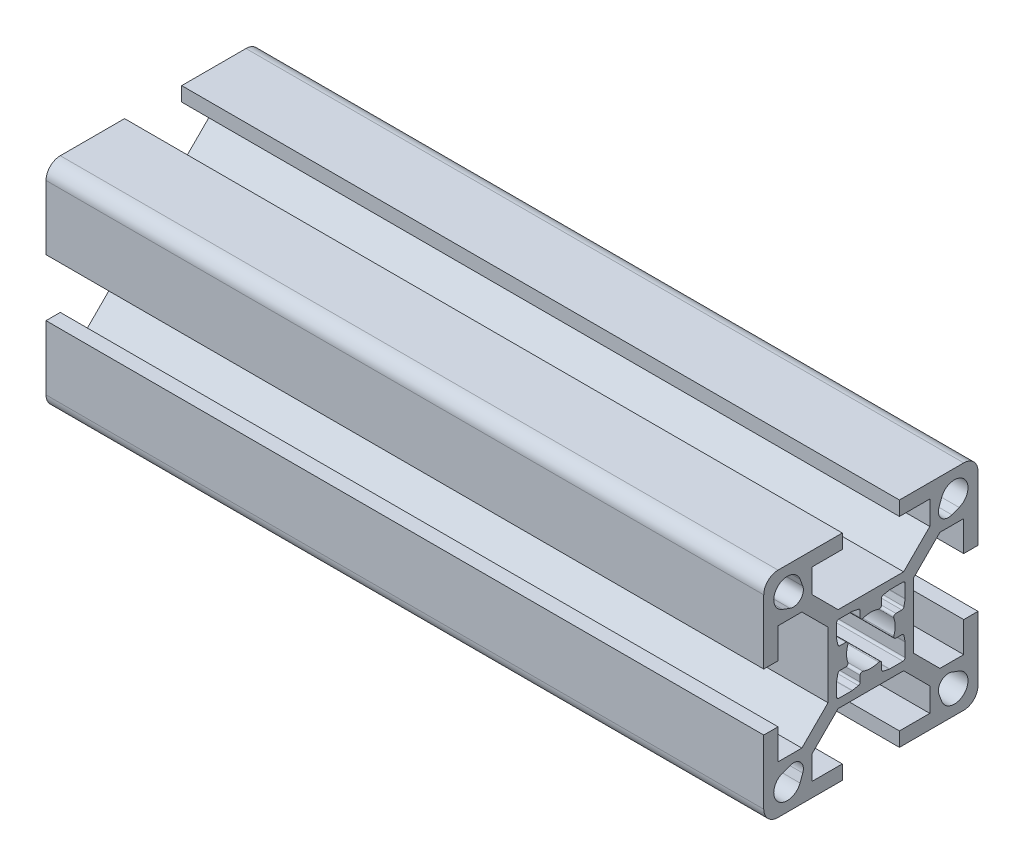
from build123d import *

# Parameters (mm, degrees)
BOSS_EXTRUDE1_DEPTH = 100.5


with BuildPart() as part:
    # Sketch1 → Boss-Extrude1 (new body)
    with BuildSketch(Plane(origin=(0, 0, 0), x_dir=(0, 0, -1), z_dir=(1, 0, 0))):
        with BuildLine():
            Line((-15, 13), (-15, 4))
            Line((-15, 4), (-13, 4))
            Line((-13, 4), (-13, 8.25))
            Line((-13, 8.25), (-9.664213562, 8.25))
            Line((-9.664213562, 8.25), (-6, 4.585786438))
            Line((-6, 4.585786438), (-6, -4.585786438))
            Line((-6, -4.585786438), (-9.664213562, -8.25))
            Line((-9.664213562, -8.25), (-13, -8.25))
            Line((-13, -8.25), (-13, -4))
            Line((-13, -4), (-15, -4))
            Line((-15, -4), (-15, -13))
            ThreePointArc((-15, -13), (-14.414213562, -14.414213562), (-13, -15))
            Line((-13, -15), (-4, -15))
            Line((-4, -15), (-4, -13))
            Line((-4, -13), (-8.25, -13))
            Line((-8.25, -13), (-8.25, -9.664213562))
            Line((-8.25, -9.664213562), (-4.585786438, -6))
            Line((-4.585786438, -6), (4.585786438, -6))
            Line((4.585786438, -6), (8.25, -9.664213562))
            Line((8.25, -9.664213562), (8.25, -13))
            Line((8.25, -13), (4, -13))
            Line((4, -13), (4, -15))
            Line((4, -15), (13, -15))
            ThreePointArc((13, -15), (14.414213562, -14.414213562), (15, -13))
            Line((15, -13), (15, -4))
            Line((15, -4), (13, -4))
            Line((13, -4), (13, -8.25))
            Line((13, -8.25), (9.664213562, -8.25))
            Line((9.664213562, -8.25), (6, -4.585786438))
            Line((6, -4.585786438), (6, 4.585786438))
            Line((6, 4.585786438), (9.664213562, 8.25))
            Line((9.664213562, 8.25), (13, 8.25))
            Line((13, 8.25), (13, 4))
            Line((13, 4), (15, 4))
            Line((15, 4), (15, 13))
            ThreePointArc((15, 13), (14.414213562, 14.414213562), (13, 15))
            Line((13, 15), (4, 15))
            Line((4, 15), (4, 13))
            Line((4, 13), (8.25, 13))
            Line((8.25, 13), (8.25, 9.664213562))
            Line((8.25, 9.664213562), (4.585786438, 6))
            Line((4.585786438, 6), (-4.585786438, 6))
            Line((-4.585786438, 6), (-8.25, 9.664213562))
            Line((-8.25, 9.664213562), (-8.25, 13))
            Line((-8.25, 13), (-4, 13))
            Line((-4, 13), (-4, 15))
            Line((-4, 15), (-13, 15))
            ThreePointArc((-13, 15), (-14.414213562, 14.414213562), (-15, 13))
        make_face()
        with BuildLine():
            Line((-9.539070071, 11.338915743), (-9.918883282, 12.361530981))
            ThreePointArc((-9.918883282, 12.361530981), (-13.043502884, 13.043502884), (-12.361530981, 9.918883282))
            Line((-12.361530981, 9.918883282), (-11.338915743, 9.539070071))
            ThreePointArc((-11.338915743, 9.539070071), (-9.861522369, 9.861522369), (-9.539070071, 11.338915743))
        make_face(mode=Mode.SUBTRACT)
        with BuildLine():
            Line((9.918883282, 12.361530981), (9.539070071, 11.338915743))
            ThreePointArc((9.539070071, 11.338915743), (9.861522369, 9.861522369), (11.338915743, 9.539070071))
            Line((11.338915743, 9.539070071), (12.361530981, 9.918883282))
            ThreePointArc((12.361530981, 9.918883282), (13.043502884, 13.043502884), (9.918883282, 12.361530981))
        make_face(mode=Mode.SUBTRACT)
        with BuildLine():
            Line((12.361530981, -9.918883282), (11.338915743, -9.539070071))
            ThreePointArc((11.338915743, -9.539070071), (9.861522369, -9.861522369), (9.539070071, -11.338915743))
            Line((9.539070071, -11.338915743), (9.918883282, -12.361530981))
            ThreePointArc((9.918883282, -12.361530981), (13.043502884, -13.043502884), (12.361530981, -9.918883282))
        make_face(mode=Mode.SUBTRACT)
        with BuildLine():
            Line((-11.338915743, -9.539070071), (-12.361530981, -9.918883282))
            ThreePointArc((-12.361530981, -9.918883282), (-13.043502884, -13.043502884), (-9.918883282, -12.361530981))
            Line((-9.918883282, -12.361530981), (-9.539070071, -11.338915743))
            ThreePointArc((-9.539070071, -11.338915743), (-9.861522369, -9.861522369), (-11.338915743, -9.539070071))
        make_face(mode=Mode.SUBTRACT)
        with BuildLine():
            Line((-4.8, -2.644433572), (-4.8, -4.5))
            ThreePointArc((-4.8, -4.5), (-4.712132034, -4.712132034), (-4.5, -4.8))
            Line((-4.5, -4.8), (-2.644433572, -4.8))
            ThreePointArc((-2.644433572, -4.8), (-2.615679847, -4.79861886), (-2.587190874, -4.794488155))
            Line((-2.587190874, -4.794488155), (-1.742757301, -4.630346896))
            ThreePointArc((-1.742757301, -4.630346896), (-1.568512625, -4.526682207), (-1.5, -4.335858741))
            Line((-1.5, -4.335858741), (-1.5, -3.5))
            ThreePointArc((-1.5, -3.5), (-1.374371458, -3.255879959), (-1.102702703, -3.216216216))
            ThreePointArc((-1.102702703, -3.216216216), (0, -3.4), (1.102702703, -3.216216216))
            ThreePointArc((1.102702703, -3.216216216), (1.374371458, -3.255879959), (1.5, -3.5))
            Line((1.5, -3.5), (1.5, -4.335858741))
            ThreePointArc((1.5, -4.335858741), (1.568512625, -4.526682207), (1.742757301, -4.630346896))
            Line((1.742757301, -4.630346896), (2.587190874, -4.794488155))
            ThreePointArc((2.587190874, -4.794488155), (2.615679847, -4.79861886), (2.644433572, -4.8))
            Line((2.644433572, -4.8), (4.5, -4.8))
            ThreePointArc((4.5, -4.8), (4.712132034, -4.712132034), (4.8, -4.5))
            Line((4.8, -4.5), (4.8, -2.644433572))
            ThreePointArc((4.8, -2.644433572), (4.79861886, -2.615679847), (4.794488155, -2.587190874))
            Line((4.794488155, -2.587190874), (4.630346896, -1.742757301))
            ThreePointArc((4.630346896, -1.742757301), (4.526682207, -1.568512625), (4.335858741, -1.5))
            Line((4.335858741, -1.5), (3.5, -1.5))
            ThreePointArc((3.5, -1.5), (3.255879959, -1.374371458), (3.216216216, -1.102702703))
            ThreePointArc((3.216216216, -1.102702703), (3.4, 0), (3.216216216, 1.102702703))
            ThreePointArc((3.216216216, 1.102702703), (3.255879959, 1.374371458), (3.5, 1.5))
            Line((3.5, 1.5), (4.335858741, 1.5))
            ThreePointArc((4.335858741, 1.5), (4.526682207, 1.568512625), (4.630346896, 1.742757301))
            Line((4.630346896, 1.742757301), (4.794488155, 2.587190874))
            ThreePointArc((4.794488155, 2.587190874), (4.79861886, 2.615679847), (4.8, 2.644433572))
            Line((4.8, 2.644433572), (4.8, 4.5))
            ThreePointArc((4.8, 4.5), (4.712132034, 4.712132034), (4.5, 4.8))
            Line((4.5, 4.8), (2.644433572, 4.8))
            ThreePointArc((2.644433572, 4.8), (2.615679847, 4.79861886), (2.587190874, 4.794488155))
            Line((2.587190874, 4.794488155), (1.742757301, 4.630346896))
            ThreePointArc((1.742757301, 4.630346896), (1.568512625, 4.526682207), (1.5, 4.335858741))
            Line((1.5, 4.335858741), (1.5, 3.5))
            ThreePointArc((1.5, 3.5), (1.374371458, 3.255879959), (1.102702703, 3.216216216))
            ThreePointArc((1.102702703, 3.216216216), (0, 3.4), (-1.102702703, 3.216216216))
            ThreePointArc((-1.102702703, 3.216216216), (-1.374371458, 3.255879959), (-1.5, 3.5))
            Line((-1.5, 3.5), (-1.5, 4.335858741))
            ThreePointArc((-1.5, 4.335858741), (-1.568512625, 4.526682207), (-1.742757301, 4.630346896))
            Line((-1.742757301, 4.630346896), (-2.587190874, 4.794488155))
            ThreePointArc((-2.587190874, 4.794488155), (-2.615679847, 4.79861886), (-2.644433572, 4.8))
            Line((-2.644433572, 4.8), (-4.5, 4.8))
            ThreePointArc((-4.5, 4.8), (-4.712132034, 4.712132034), (-4.8, 4.5))
            Line((-4.8, 4.5), (-4.8, 2.644433572))
            ThreePointArc((-4.8, 2.644433572), (-4.79861886, 2.615679847), (-4.794488155, 2.587190874))
            Line((-4.794488155, 2.587190874), (-4.630346896, 1.742757301))
            ThreePointArc((-4.630346896, 1.742757301), (-4.526682207, 1.568512625), (-4.335858741, 1.5))
            Line((-4.335858741, 1.5), (-3.5, 1.5))
            ThreePointArc((-3.5, 1.5), (-3.255879959, 1.374371458), (-3.216216216, 1.102702703))
            ThreePointArc((-3.216216216, 1.102702703), (-3.4, 0), (-3.216216216, -1.102702703))
            ThreePointArc((-3.216216216, -1.102702703), (-3.255879959, -1.374371458), (-3.5, -1.5))
            Line((-3.5, -1.5), (-4.335858741, -1.5))
            ThreePointArc((-4.335858741, -1.5), (-4.526682207, -1.568512625), (-4.630346896, -1.742757301))
            Line((-4.630346896, -1.742757301), (-4.794488155, -2.587190874))
            ThreePointArc((-4.794488155, -2.587190874), (-4.79861886, -2.615679847), (-4.8, -2.644433572))
        make_face(mode=Mode.SUBTRACT)
    extrude(amount=BOSS_EXTRUDE1_DEPTH)


solid = part.part
